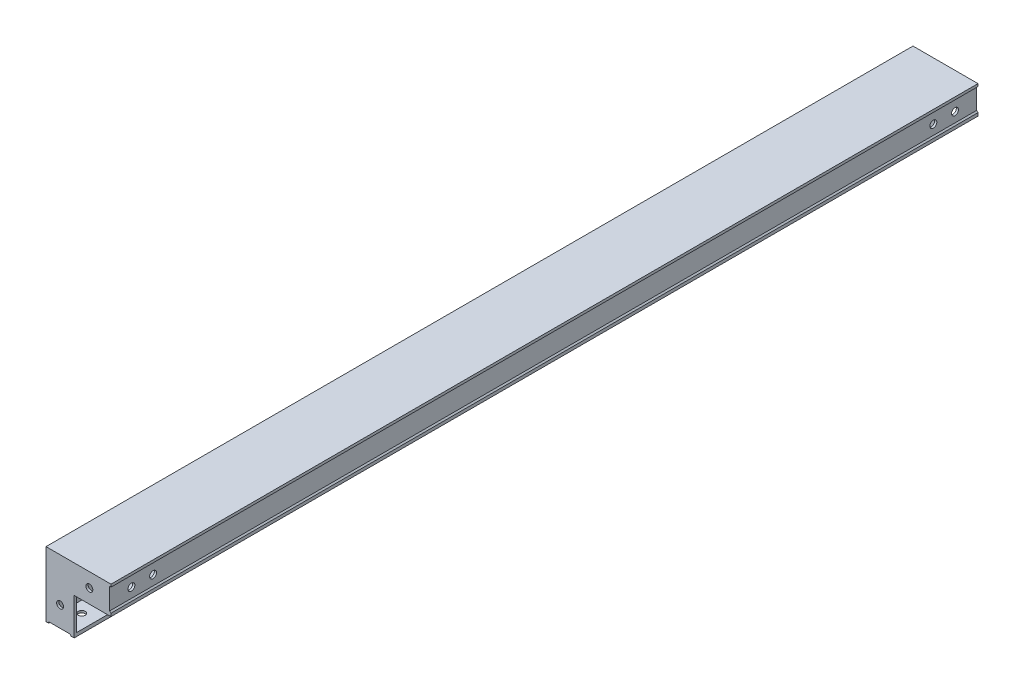
from build123d import *

# Parameters (mm, degrees)
EXTRUDE_1_DEPTH             = 2000
EXTRUDE_2_DEPTH             = 5
HOLE_WIZARD_16_0_16_1_D     = 16
HOLE_WIZARD_16_0_16_2_D     = 16
HOLE_WIZARD_16_0_16_2_DEPTH = 5
HOLE_WIZARD_16_0_16_3_D     = 16
HOLE_WIZARD_16_0_16_3_DEPTH = 5


with BuildPart() as part:
    # Model → 凸台-拉伸1 (new body)
    with BuildSketch(Plane.XY):
        with BuildLine():
            Line((55, -147), (6, -147))
            Line((6, -147), (6, -150))
            Line((6, -150), (0, -150))
            Line((0, -150), (0, 0))
            Line((0, 0), (150, 0))
            Line((150, 0), (150, -6))
            Line((150, -6), (147, -6))
            Line((147, -6), (147, -55))
            Line((147, -55), (150, -58))
            Line((150, -58), (150, -65))
            Line((150, -65), (142, -65))
            Line((142, -65), (142, -6))
            Line((142, -6), (9, -6))
            ThreePointArc((9, -6), (6.878679656, -6.878679656), (6, -9))
            Line((6, -9), (6, -142))
            Line((6, -142), (65, -142))
            Line((65, -142), (65, -150))
            Line((65, -150), (58, -150))
            Line((58, -150), (55, -147))
        make_face()
    extrude(amount=EXTRUDE_1_DEPTH)

    # 草图2 → 凸台-拉伸2 (add)
    with BuildSketch(Plane.XY.offset(2000)):
        Polygon((65, -142), (65, -65), (142, -65), (142, -6), (6, -6), (6, -142), align=None)
    extrude_2 = extrude(amount=-EXTRUDE_2_DEPTH)

    # 镜向1: 凸台-拉伸2 across plane
    add(extrude_2.mirror(Plane.XY.offset(1000)))

    # Ø16.0 (16) 直径孔1 (through all)
    with Locations(Plane.XY.offset(2000)):
        with Locations((100, -32.5), (32.5, -100)):
            Hole(HOLE_WIZARD_16_0_16_1_D / 2)

    # Ø16.0 (16) 直径孔2
    with Locations(Plane(origin=(147, 0, 0), x_dir=(0, 0, -1), z_dir=(1, 0, 0))):
        with Locations((-1950, -32.5), (-1900, -32.5), (-50, -32.5), (-100, -32.5)):
            Hole(HOLE_WIZARD_16_0_16_2_D / 2, depth=HOLE_WIZARD_16_0_16_2_DEPTH)

    # Ø16.0 (16) 直径孔3
    with Locations(Plane(origin=(0, -147, 0), x_dir=(-1, 0, 0), z_dir=(0, -1, 0))):
        with Locations((-32.5, -1950), (-32.5, -1900), (-32.5, -50), (-32.5, -100)):
            Hole(HOLE_WIZARD_16_0_16_3_D / 2, depth=HOLE_WIZARD_16_0_16_3_DEPTH)


solid = part.part
